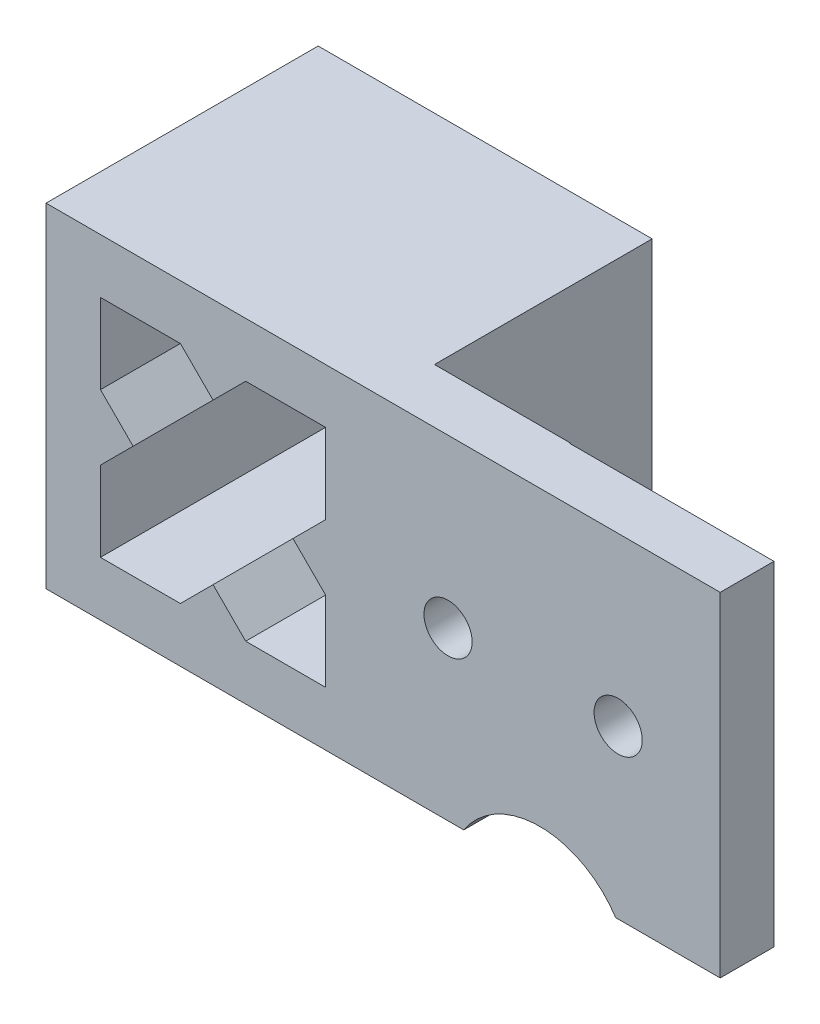
from build123d import *

# Parameters (mm, degrees)
SKETCH1_W            = 31.176
SKETCH1_H            = 31.176
BOSS_EXTRUDE1_DEPTH  = 25.4
BOSS_EXTRUDE2_DEPTH  = 12.7
CUT_EXTRUDE1_DEPTH   = 12.7
SKETCH29_R           = 8.46875
CUT_EXTRUDE10_DEPTH  = 42.089617764
CUT_EXTRUDE11_DEPTH  = 50.166186754
SKETCH30_R           = 2.25
BOSS_EXTRUDE15_DEPTH = 5.019


with BuildPart() as part:
    # Sketch1 → Boss-Extrude1 (new body)
    with BuildSketch(Plane.XY):
        Rectangle(SKETCH1_W, SKETCH1_H)
        Polygon((2.54, -10), (3.048, -10.508), (10.508, -10.508), (10.508, -3.048), (10, -2.54), (7.46, 0), (10, 2.54), (10.508, 3.048), (10.508, 10.508), (3.048, 10.508), (2.54, 10), (0, 7.46), (-2.54, 10), (-3.048, 10.508), (-10.508, 10.508), (-10.508, 3.048), (-10, 2.54), (-7.46, 0), (-10, -2.54), (-10.508, -3.048), (-10.508, -10.508), (-3.048, -10.508), (-2.54, -10), (0, -7.46), align=None, mode=Mode.SUBTRACT)
    extrude(amount=BOSS_EXTRUDE1_DEPTH)

    # Sketch3 → Boss-Extrude2 (add)
    with BuildSketch(Plane(origin=(15.588, 0, 0), x_dir=(0, 0, -1), z_dir=(1, 0, 0))):
        Polygon((-20.381, 10.381), (0, 10.381), (0, 15.588), (-25.4, 15.588), (-25.4, -15.588), (0, -15.588), (0, -10.381), (-20.381, -10.381), align=None)
    extrude(amount=BOSS_EXTRUDE2_DEPTH)

    # Sketch4 → Cut-Extrude1 (cut)
    with BuildSketch(Plane(origin=(0, 0, 20.381), x_dir=(-1, 0, 0), z_dir=(0, 0, -1))):
        with BuildLine():
            ThreePointArc((-24.188, 0), (-21.938, -2.25), (-19.688, 0))
            Line((-19.688, 0), (-24.188, 0))
        make_face()
        with BuildLine():
            Line((-24.188, 0), (-19.688, 0))
            ThreePointArc((-19.688, 0), (-21.938, 2.25), (-24.188, 0))
        make_face()
    extrude(amount=-CUT_EXTRUDE1_DEPTH, mode=Mode.SUBTRACT)

    # Sketch29 → Cut-Extrude10 (cut, through all)
    with BuildSketch(Plane.XY.offset(25.4)):
        with Locations((30.492, -20.220089154)):
            Circle(SKETCH29_R)
    extrude(amount=-CUT_EXTRUDE10_DEPTH, mode=Mode.SUBTRACT)

    # Sketch5 → Cut-Extrude11 (cut, through all)
    with BuildSketch(Plane.XZ.offset(15.588)):
        with BuildLine():
            Line((24.188, 10.32), (28.288, 10.32))
            Line((28.288, 10.32), (28.288, 20.32))
            Line((28.288, 20.32), (15.588, 20.32))
            Line((15.588, 20.32), (15.588, 10.32))
            Line((15.588, 10.32), (19.688, 10.32))
            ThreePointArc((19.688, 10.32), (21.938, 12.57), (24.188, 10.32))
        make_face()
        with BuildLine():
            Line((15.588, 0), (28.288, 0))
            Line((28.288, 0), (28.288, 10.32))
            Line((28.288, 10.32), (24.188, 10.32))
            ThreePointArc((24.188, 10.32), (21.938, 8.07), (19.688, 10.32))
            Line((19.688, 10.32), (15.588, 10.32))
            Line((15.588, 10.32), (15.588, 0))
        make_face()
        with BuildLine():
            ThreePointArc((19.688, 10.32), (21.938, 8.07), (24.188, 10.32))
            Line((24.188, 10.32), (19.688, 10.32))
        make_face()
        with BuildLine():
            Line((19.688, 10.32), (24.188, 10.32))
            ThreePointArc((24.188, 10.32), (21.938, 12.57), (19.688, 10.32))
        make_face()
    extrude(amount=-CUT_EXTRUDE11_DEPTH, mode=Mode.SUBTRACT)

    # Sketch30 → Boss-Extrude15 (add)
    with BuildSketch(Plane.XY.offset(25.4)):
        with BuildLine():
            Line((47.338, 15.588), (28.288, 15.588))
            Line((28.288, 15.588), (28.288, -12.043163658))
            ThreePointArc((28.288, -12.043163658), (33.510098515, -12.307389999), (37.581673944, -15.588))
            Line((37.581673944, -15.588), (47.338, -15.588))
            Line((47.338, -15.588), (47.338, 15.588))
        make_face()
        with Locations((37.813, 0)):
            Circle(SKETCH30_R, mode=Mode.SUBTRACT)
    extrude(amount=-BOSS_EXTRUDE15_DEPTH)


solid = part.part
